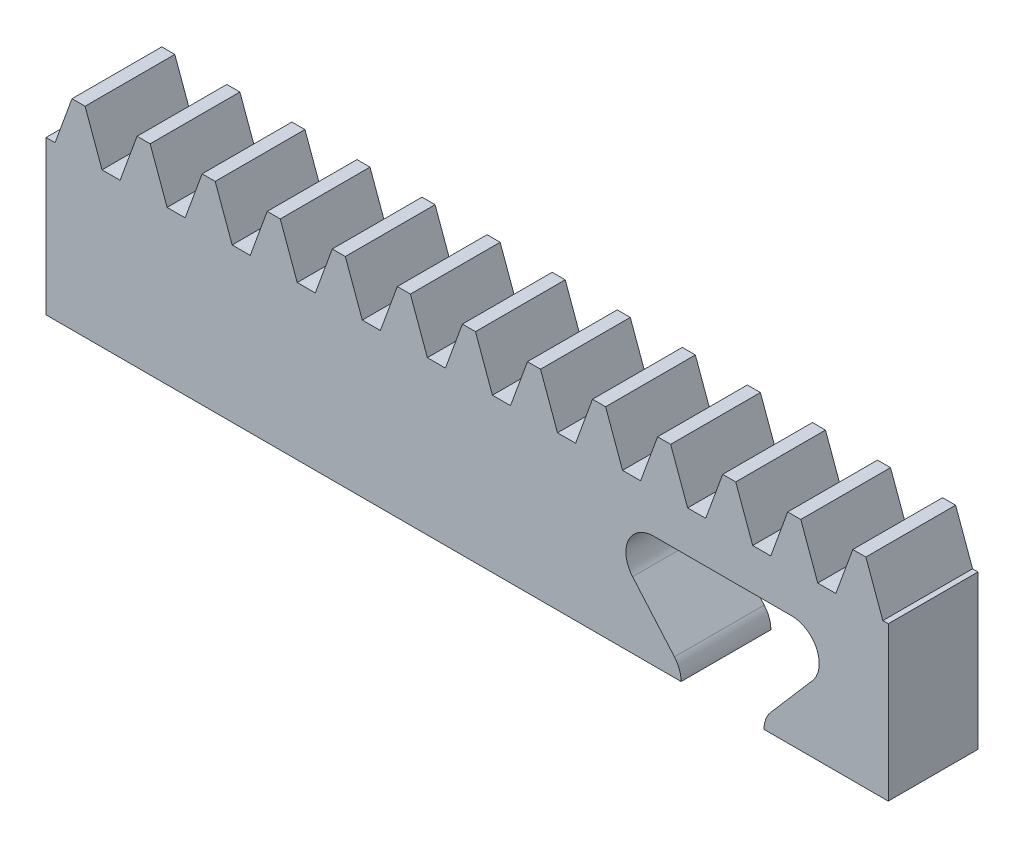
from build123d import *

# Parameters (mm, degrees)
BLANKSKE_W         = 61
BLANKSKE_H         = 14.5
BLANK_DEPTH        = 6.5
TOOTHCUTSIM_DEPTH  = 64.035704168
TEETHCUTS_COUNT    = 14
TEETHCUTS_PITCH    = 4.712388975
CUT_EXTRUDE1_DEPTH = 6.5


with BuildPart() as part:
    # BlankSke → Blank (new body)
    with BuildSketch(Plane.XY):
        with Locations((30.5, 7.25)):
            Rectangle(BLANKSKE_W, BLANKSKE_H)
    extrude(amount=-BLANK_DEPTH)

    # TooCutSkeSim → ToothCutSim (cut, through all)
    with BuildSketch(Plane.XY):
        Polygon((0.654653055, 11.125), (-0.654653055, 11.125), (-1.892297439, 14.5254), (1.892297439, 14.5254), align=None)
    toothcutsim = extrude(amount=-TOOTHCUTSIM_DEPTH, mode=Mode.SUBTRACT)

    # TeethCuts: ToothCutSim ×14
    with Locations(*[(i * TEETHCUTS_PITCH, 0, 0) for i in range(1, TEETHCUTS_COUNT)]):
        add(toothcutsim, mode=Mode.SUBTRACT)

    # Sketch1 → Cut-Extrude1 (cut)
    with BuildSketch(Plane(origin=(0, 0, -6.5), x_dir=(-1, 0, 0), z_dir=(0, 0, -1))):
        with BuildLine():
            Line((-44, 8.125), (-54, 8.125))
            ThreePointArc((-54, 8.125), (-55.81827458, 6.957993128), (-55.51461023, 4.818877551))
            Line((-55.51461023, 4.818877551), (-52.48538977, 1.306122449))
            ThreePointArc((-52.48538977, 1.306122449), (-52.125270625, 0.696699196), (-52, 0))
            Line((-52, 0), (-46, 0))
            ThreePointArc((-46, 0), (-45.874729375, 0.696699196), (-45.51461023, 1.306122449))
            Line((-45.51461023, 1.306122449), (-42.48538977, 4.818877551))
            ThreePointArc((-42.48538977, 4.818877551), (-42.18172542, 6.957993128), (-44, 8.125))
        make_face()
    extrude(amount=-CUT_EXTRUDE1_DEPTH, mode=Mode.SUBTRACT)


solid = part.part
